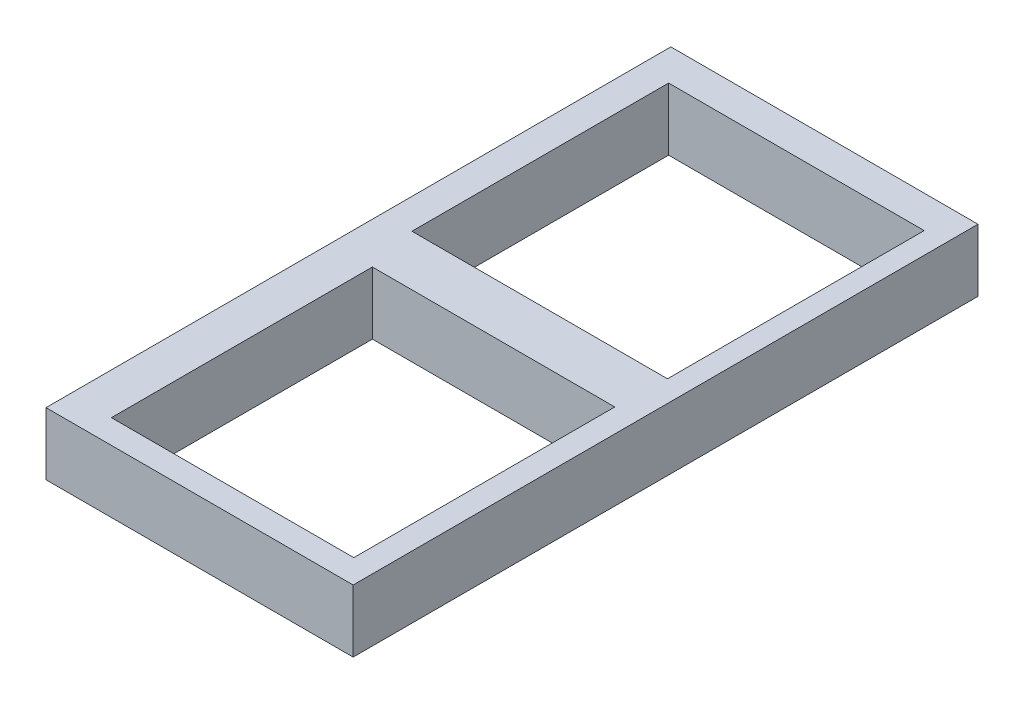
from build123d import *

# Parameters (mm, degrees)
SKETCH1_W           = 49.15505924
SKETCH1_H           = 100
BOSS_EXTRUDE1_DEPTH = 10
SKETCH2_W           = 40.899596349
SKETCH2_H           = 41.079980186
SKETCH2_W_2         = 38.793706507
SKETCH2_H_2         = 41.766163391
CUT_EXTRUDE1_DEPTH  = 57.604372289


with BuildPart() as part:
    # Sketch1 → Boss-Extrude1 (new body)
    with BuildSketch(Plane(origin=(0, 0, 0), x_dir=(1, 0, 0), z_dir=(0, 1, 0))):
        Rectangle(SKETCH1_W, SKETCH1_H)
    extrude(amount=BOSS_EXTRUDE1_DEPTH)

    # Sketch2 → Cut-Extrude1 (cut, through all)
    with BuildSketch(Plane(origin=(0, 0, 0), x_dir=(-1, 0, 0), z_dir=(0, -1, 0))):
        with Locations((-0.705482523, 24.26945138)):
            Rectangle(SKETCH2_W, SKETCH2_H)
        with Locations((-1.443590916, -25.27394091)):
            Rectangle(SKETCH2_W_2, SKETCH2_H_2)
    extrude(amount=-CUT_EXTRUDE1_DEPTH, mode=Mode.SUBTRACT)


solid = part.part
